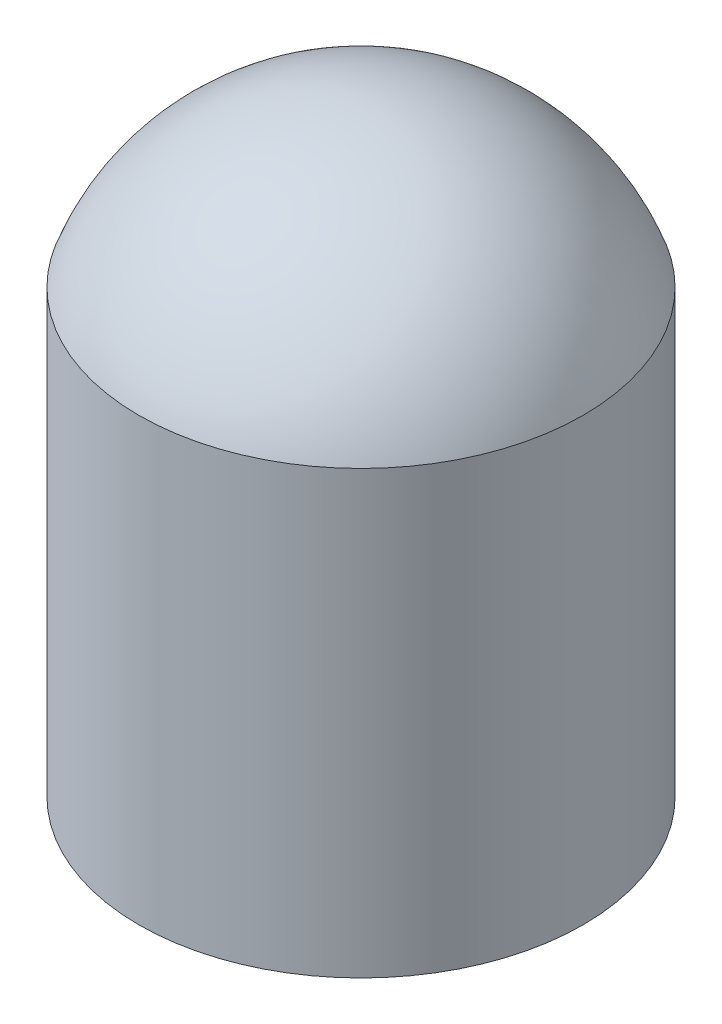
from build123d import *


with BuildPart() as part:
    # Sketch2 → Revolve1 (revolve)
    with BuildSketch(Plane.XY):
        with BuildLine():
            Line((0, 0), (0, 8))
            ThreePointArc((0, 8), (2.436030801, 7.230075618), (3.987102238, 5.2))
            Line((3.987102238, 5.2), (3.987102238, -2.722114739))
            Line((3.987102238, -2.722114739), (2.987102238, -2.722114739))
            ThreePointArc((2.987102238, -2.722114739), (2.020686049, -0.782607862), (0, 0))
        make_face()
    revolve(axis=Axis((0, 0, 0), (0, 1, 0)))


solid = part.part
